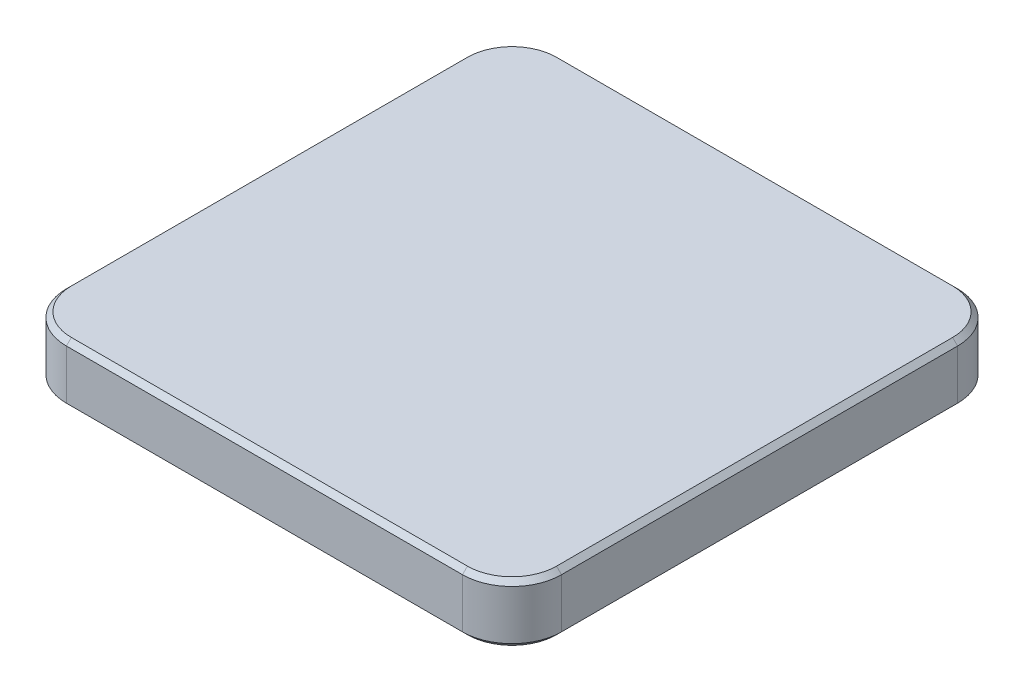
from build123d import *

# Parameters (mm, degrees)
CROQUIS1_W              = 100
CROQUIS1_H              = 100
SALIENTE_EXTRUIR1_DEPTH = 12
REDONDEO1_R             = 10
CHAFL_N1_SIZE           = 1
CHAFL_N2_SIZE           = 1


with BuildPart() as part:
    # Croquis1 → Saliente-Extruir1 (new body)
    with BuildSketch(Plane(origin=(0, 0, 0), x_dir=(1, 0, 0), z_dir=(0, 1, 0))):
        Rectangle(CROQUIS1_W, CROQUIS1_H)
    extrude(amount=SALIENTE_EXTRUIR1_DEPTH)

    # Redondeo1
    redondeo1_edges = [part.edges().sort_by_distance(p)[0] for p in [
        (50, 6, 50),
        (-50, 6, 50),
        (-50, 6, -50),
        (50, 6, -50),
    ]]
    fillet(redondeo1_edges, radius=REDONDEO1_R)

    # Chaflán1
    chafl_n1_edges = [part.edges().sort_by_distance(p)[0] for p in [
        (-50, 12, 0),
        (0, 12, -50),
        (50, 12, 0),
        (0, 12, 50),
        (47.071067812, 12, 47.071067812),
        (-47.071067812, 12, 47.071067812),
        (47.071067812, 12, -47.071067812),
        (-47.071067812, 12, -47.071067812),
    ]]
    chamfer(chafl_n1_edges, length=CHAFL_N1_SIZE)

    # Chaflán2
    chafl_n2_edges = [part.edges().sort_by_distance(p)[0] for p in [
        (-50, 0, 0),
        (50, 0, 0),
        (0, 0, 50),
        (0, 0, -50),
        (47.071067812, 0, 47.071067812),
        (-47.071067812, 0, 47.071067812),
        (47.071067812, 0, -47.071067812),
        (-47.071067812, 0, -47.071067812),
    ]]
    chamfer(chafl_n2_edges, length=CHAFL_N2_SIZE)


solid = part.part
